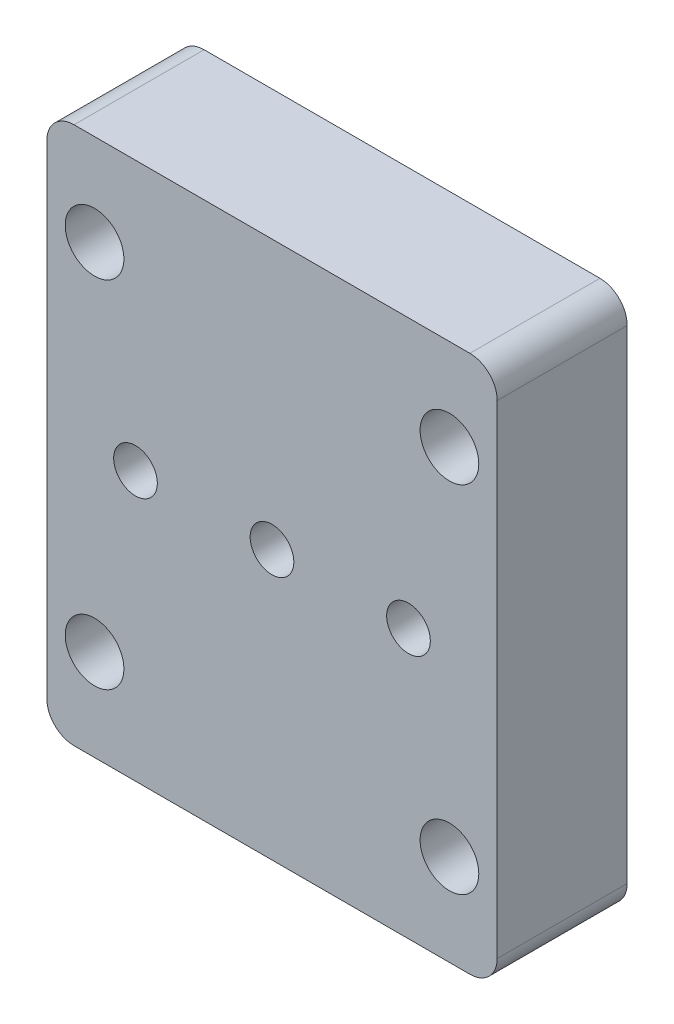
from build123d import *

# Parameters (mm, degrees)
SKETCH1_W            = 33
SKETCH1_H            = 39.4
BOSS_EXTRUDE1_DEPTH  = 9.525
M3_CLEARANCE_HOLE1_D = 3.2
M4_CLEARANCE_HOLE1_D = 4.3
FILLET1_R            = 2


with BuildPart() as part:
    # Sketch1 → Boss-Extrude1 (new body)
    with BuildSketch(Plane.XY):
        Rectangle(SKETCH1_W, SKETCH1_H)
    extrude(amount=BOSS_EXTRUDE1_DEPTH)

    # M3 Clearance Hole1 (through all)
    with Locations(Plane.XY.offset(9.525)):
        with Locations((-10, 0), (0, 0), (10, 0)):
            Hole(M3_CLEARANCE_HOLE1_D / 2)

    # M4 Clearance Hole1 (through all)
    with Locations(Plane.XY.offset(9.525)):
        with Locations((-13, 13), (-13, -13), (13, -13), (13, 13)):
            Hole(M4_CLEARANCE_HOLE1_D / 2)

    # Fillet1
    fillet1_edges = [part.edges().sort_by_distance(p)[0] for p in [
        (-16.5, 19.7, 4.7625),
        (16.5, 19.7, 4.7625),
        (16.5, -19.7, 4.7625),
        (-16.5, -19.7, 4.7625),
    ]]
    fillet(fillet1_edges, radius=FILLET1_R)


solid = part.part
